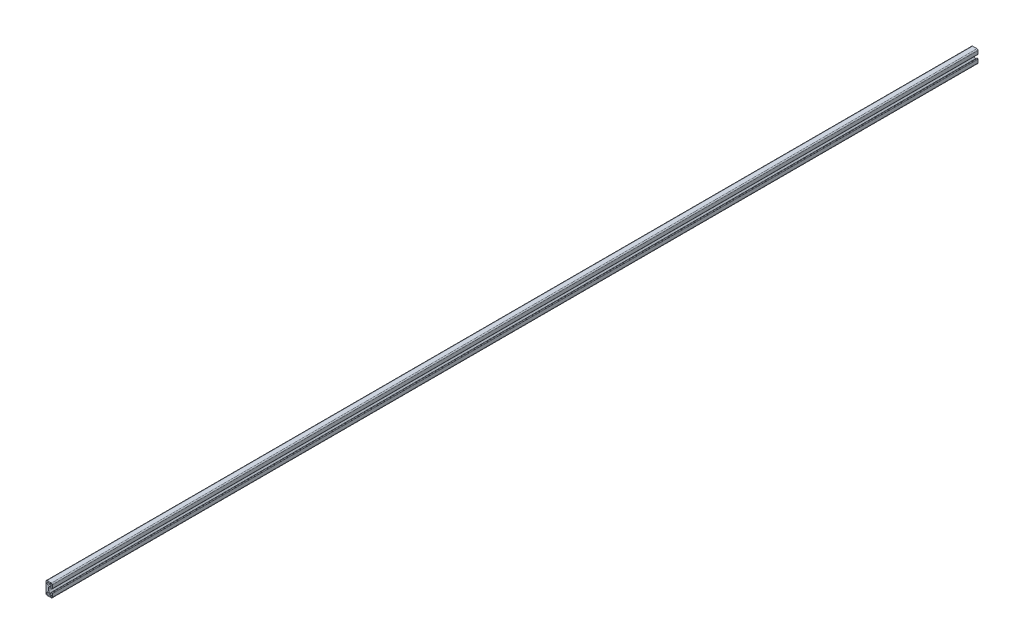
from build123d import *

# Parameters (mm, degrees)
SKETCH3_R           = 2.201333333
SKETCH3_R_2         = 1.693333333
BOSS_EXTRUDE1_DEPTH = 914.4


with BuildPart() as part:
    # Sketch3 → Boss-Extrude1 (new, symmetric)
    with BuildSketch(Plane.XY):
        with BuildLine():
            Line((-1.778, 0), (-1.778, 1.27))
            ThreePointArc((-1.778, 1.27), (-1.536070654, 2.494011801), (-0.846666667, 3.533942971))
            Line((-0.846666667, 3.533942971), (2.413267273, 6.793876912))
            ThreePointArc((2.413267273, 6.793876912), (2.578074335, 6.903997469), (2.772477518, 6.942666667))
            Line((2.772477518, 6.942666667), (3.048, 6.942666667))
            ThreePointArc((3.048, 6.942666667), (3.467078619, 6.769078619), (3.640666667, 6.35))
            Line((3.640666667, 6.35), (3.640666667, 4.301066667))
            ThreePointArc((3.640666667, 4.301066667), (3.948165494, 3.558698827), (4.690533333, 3.2512))
            Line((4.690533333, 3.2512), (5.300133333, 3.2512))
            ThreePointArc((5.300133333, 3.2512), (6.042501173, 3.558698827), (6.35, 4.301066667))
            Line((6.35, 4.301066667), (6.35, 10.583333333))
            ThreePointArc((6.35, 10.583333333), (5.730042687, 12.080042687), (4.233333333, 12.7))
            Line((4.233333333, 12.7), (-4.233333333, 12.7))
            ThreePointArc((-4.233333333, 12.7), (-5.730042687, 12.080042687), (-6.35, 10.583333333))
            Line((-6.35, 10.583333333), (-6.35, 0))
            Line((-6.35, 0), (-1.778, 0))
        make_face()
        with Locations(Location((-2.116666667, 8.466666667, 0), (0, 0, 180))):
            Circle(SKETCH3_R, mode=Mode.SUBTRACT)
        with Locations(Location((3.429, 9.906, 0), (0, 0, 180))):
            Circle(SKETCH3_R_2, mode=Mode.SUBTRACT)
    extrude(amount=BOSS_EXTRUDE1_DEPTH, both=True)

    # Mirror1: part across plane


with BuildPart() as part_1:
    add(part.part)
    add(part.part.mirror(Plane.ZX))


solid = part_1.part
